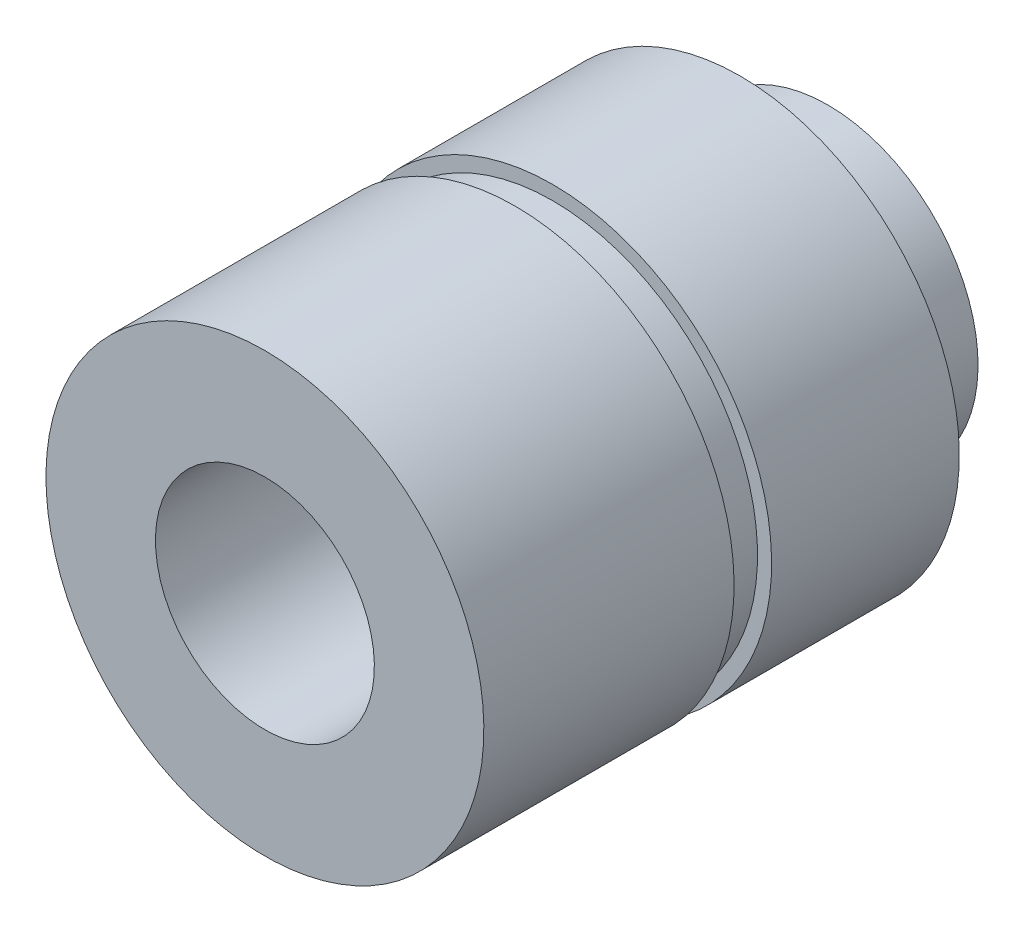
from build123d import *


with BuildPart() as part:
    # Sketch1 → Revolve1 (revolve)
    with BuildSketch(Plane(origin=(0, 0, 0), x_dir=(0, 0, -1), z_dir=(1, 0, 0))):
        Polygon((0, 7), (8, 7), (8, 6.55), (9.2, 6.55), (9.2, 7), (15.2, 7), (15.2, 4.8), (18, 4.8), (18, 3.5), (0, 3.5), align=None)
    revolve(axis=Axis((0, 0, -18), (0, 0, 1)))


solid = part.part
